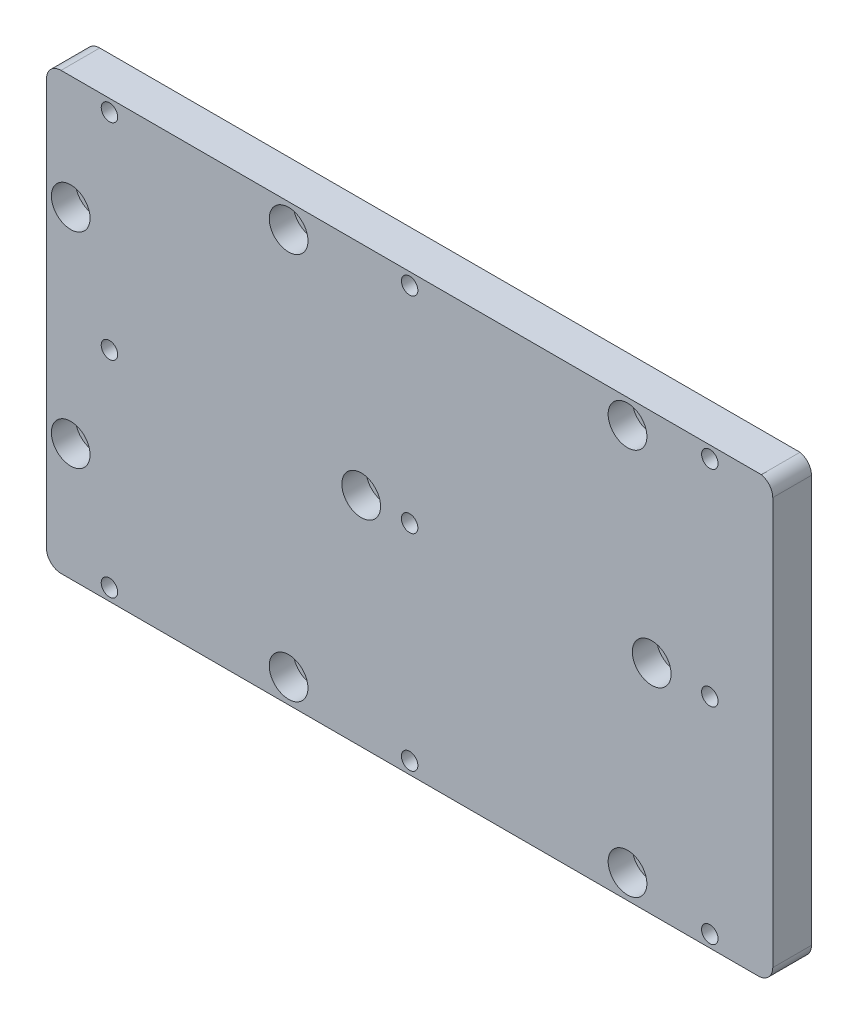
from build123d import *

# Parameters (mm, degrees)
ESQUISSE1_R             = 1.25
BOSS_EXTRU_1_DEPTH      = 8
ESQUISSE4_R             = 1.6
ENL_V_MAT_EXTRU_1_DEPTH = 181.445459873
ESQUISSE5_R             = 4
ENL_V_MAT_EXTRU_2_DEPTH = 5
TROU_TARAUD_M3_D        = 3.4


with BuildPart() as part:
    # Esquisse1 → Boss.-Extru.1 (new body)
    with BuildSketch(Plane.XY):
        with BuildLine():
            Line((2.96841177, 10.030192742), (146.96841177, 10.030192742))
            ThreePointArc((146.96841177, 10.030192742), (149.089732114, 10.908872398), (149.96841177, 13.030192742))
            Line((149.96841177, 13.030192742), (149.96841177, 97.09690847))
            ThreePointArc((149.96841177, 97.09690847), (149.301594422, 98.982712998), (147.597572626, 100.030192742))
            Line((147.597572626, 100.030192742), (2.96841177, 100.030192742))
            ThreePointArc((2.96841177, 100.030192742), (0.847091427, 99.151513085), (-0.03158823, 97.030192742))
            Line((-0.03158823, 97.030192742), (-0.03158823, 13.030192742))
            ThreePointArc((-0.03158823, 13.030192742), (0.847091427, 10.908872398), (2.96841177, 10.030192742))
        make_face()
        with Locations((12.96841177, 97.530192742)):
            Circle(ESQUISSE1_R, mode=Mode.SUBTRACT)
        with Locations((74.96841177, 97.530192742)):
            Circle(ESQUISSE1_R, mode=Mode.SUBTRACT)
        with Locations((136.96841177, 97.530192742)):
            Circle(ESQUISSE1_R, mode=Mode.SUBTRACT)
        with Locations((12.96841177, 55.030192742)):
            Circle(ESQUISSE1_R, mode=Mode.SUBTRACT)
        with Locations((74.96841177, 55.030192742)):
            Circle(ESQUISSE1_R, mode=Mode.SUBTRACT)
        with Locations((136.96841177, 55.030192742)):
            Circle(ESQUISSE1_R, mode=Mode.SUBTRACT)
        with Locations((136.96841177, 12.530192742)):
            Circle(ESQUISSE1_R, mode=Mode.SUBTRACT)
        with Locations((74.96841177, 12.530192742)):
            Circle(ESQUISSE1_R, mode=Mode.SUBTRACT)
        with Locations((12.96841177, 12.530192742)):
            Circle(ESQUISSE1_R, mode=Mode.SUBTRACT)
    extrude(amount=BOSS_EXTRU_1_DEPTH)

    # Esquisse4 → Enlèv. mat.-Extru.1 (cut, through all)
    with BuildSketch(Plane.XY.offset(8)):
        with Locations((119.96841177, 95.030192742)):
            Circle(ESQUISSE4_R)
        with Locations((49.96841177, 95.030192742)):
            Circle(ESQUISSE4_R)
        with Locations((4.96841177, 76.55605286)):
            Circle(ESQUISSE4_R)
        with Locations((4.96841177, 34.250278271)):
            Circle(ESQUISSE4_R)
        with Locations((49.96841177, 15.030192742)):
            Circle(ESQUISSE4_R)
        with Locations((119.96841177, 15.030192742)):
            Circle(ESQUISSE4_R)
        with Locations((64.96841177, 55.030192742)):
            Circle(ESQUISSE4_R)
        with Locations((124.96841177, 55.030192742)):
            Circle(ESQUISSE4_R)
    extrude(amount=-ENL_V_MAT_EXTRU_1_DEPTH, mode=Mode.SUBTRACT)

    # Esquisse5 → Enlèv. mat.-Extru.2 (cut)
    with BuildSketch(Plane.XY.offset(8)):
        with Locations((49.96841177, 95.030192742)):
            Circle(ESQUISSE5_R)
        with Locations((119.96841177, 95.030192742)):
            Circle(ESQUISSE5_R)
        with Locations((124.96841177, 55.030192742)):
            Circle(ESQUISSE5_R)
        with Locations((64.96841177, 55.030192742)):
            Circle(ESQUISSE5_R)
        with Locations((4.96841177, 76.55605286)):
            Circle(ESQUISSE5_R)
        with Locations((4.96841177, 34.250278271)):
            Circle(ESQUISSE5_R)
        with Locations((49.96841177, 15.030192742)):
            Circle(ESQUISSE5_R)
        with Locations((119.96841177, 15.030192742)):
            Circle(ESQUISSE5_R)
    extrude(amount=-ENL_V_MAT_EXTRU_2_DEPTH, mode=Mode.SUBTRACT)

    # Trou taraudé M3 (through all)
    with Locations(Plane.XY.offset(8)):
        with Locations((12.96841177, 97.530192742), (12.96841177, 55.030192742), (12.96841177, 12.530192742), (74.96841177, 12.530192742), (74.96841177, 55.030192742), (74.96841177, 97.530192742), (136.96841177, 97.530192742), (136.96841177, 55.030192742), (136.96841177, 12.530192742)):
            Hole(TROU_TARAUD_M3_D / 2)


solid = part.part
